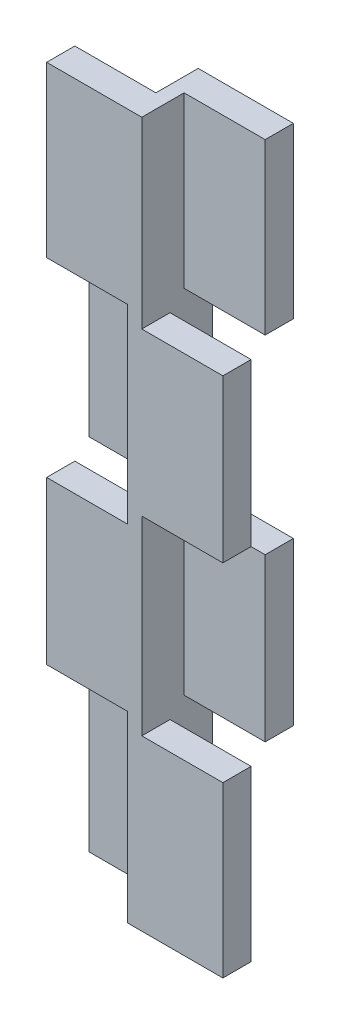
from build123d import *

# Parameters (mm, degrees)
SKETCH1_W           = 0.25
SKETCH1_H           = 1
BOSS_EXTRUDE1_DEPTH = 0.1
CUT_EXTRUDE1_DEPTH  = 0.115
CUT_EXTRUDE2_DEPTH  = 0.115


with BuildPart() as part:
    # Sketch1 → Boss-Extrude1 (new body)
    with BuildSketch(Plane.XY):
        with Locations((0.125, 0.5)):
            Rectangle(SKETCH1_W, SKETCH1_H)
    extrude(amount=BOSS_EXTRUDE1_DEPTH)

    # Sketch2 → Cut-Extrude1 (cut)
    with BuildSketch(Plane.ZY):
        Polygon((0.04, 0), (0.1, 0), (0.1, 0.26), (0.06, 0.26), (0.06, 0.49), (0.1, 0.49), (0.1, 0.76), (0.06, 0.76), (0.06, 1), (0, 1), (0, 0.74), (0.04, 0.74), (0.04, 0.51), (0, 0.51), (0, 0.24), (0.04, 0.24), align=None)
    extrude(amount=-CUT_EXTRUDE1_DEPTH, mode=Mode.SUBTRACT)

    # Sketch3 → Cut-Extrude2 (cut)
    with BuildSketch(Plane(origin=(0.25, 0, 0), x_dir=(0, 0, -1), z_dir=(1, 0, 0))):
        Polygon((-0.04, 1), (-0.1, 1), (-0.1, 0.739819694), (-0.06, 0.739819694), (-0.06, 0.51), (-0.1, 0.51), (-0.1, 0.24), (-0.06, 0.24), (-0.06, 0), (0, 0), (0, 0.26), (-0.04, 0.26), (-0.04, 0.49), (0, 0.49), (0, 0.759819694), (-0.04, 0.759819694), align=None)
    extrude(amount=-CUT_EXTRUDE2_DEPTH, mode=Mode.SUBTRACT)


solid = part.part
